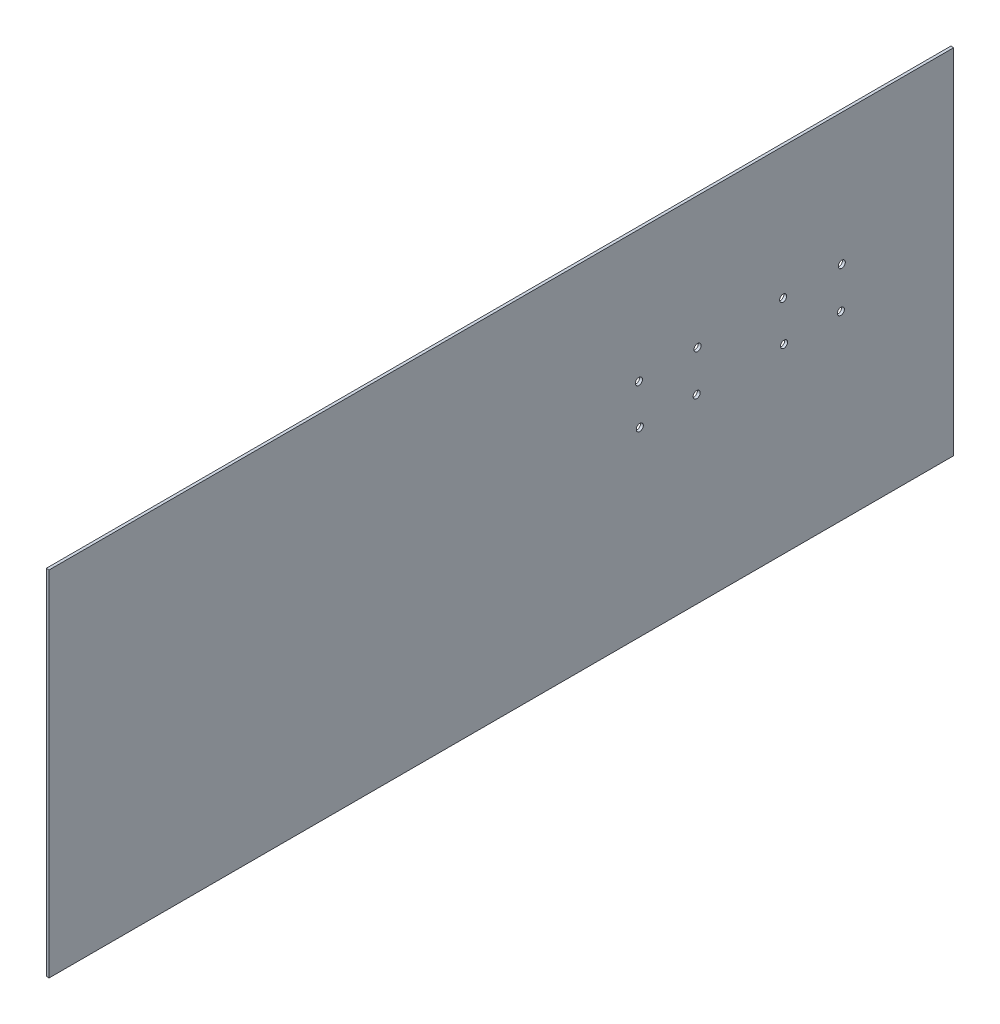
from build123d import *

# Parameters (mm, degrees)
SKETCH1_W           = 640
SKETCH1_H           = 250
SKETCH1_R           = 2.5
BOSS_EXTRUDE1_DEPTH = 2


with BuildPart() as part:
    # Sketch1 → Boss-Extrude1 (new body)
    with BuildSketch(Plane(origin=(0, 0, 0), x_dir=(0, 0, -1), z_dir=(1, 0, 0))):
        with Locations((1.245136187, 10.719844358)):
            Rectangle(SKETCH1_W, SKETCH1_H)
        with Locations((98.518732357, 42.610241257)):
            Circle(SKETCH1_R, mode=Mode.SUBTRACT)
        with Locations((140.009766973, 42.610241257)):
            Circle(SKETCH1_R, mode=Mode.SUBTRACT)
        with Locations((99.146251242, 14.070241257)):
            Circle(SKETCH1_R, mode=Mode.SUBTRACT)
        with Locations((139.36290493, 14.070241257)):
            Circle(SKETCH1_R, mode=Mode.SUBTRACT)
        with Locations((200.545763818, 42.610241257)):
            Circle(SKETCH1_R, mode=Mode.SUBTRACT)
        with Locations((201.173282704, 14.070241257)):
            Circle(SKETCH1_R, mode=Mode.SUBTRACT)
        with Locations((241.389936391, 14.070241257)):
            Circle(SKETCH1_R, mode=Mode.SUBTRACT)
        with Locations((242.036798434, 42.610241257)):
            Circle(SKETCH1_R, mode=Mode.SUBTRACT)
    extrude(amount=BOSS_EXTRUDE1_DEPTH)


solid = part.part
